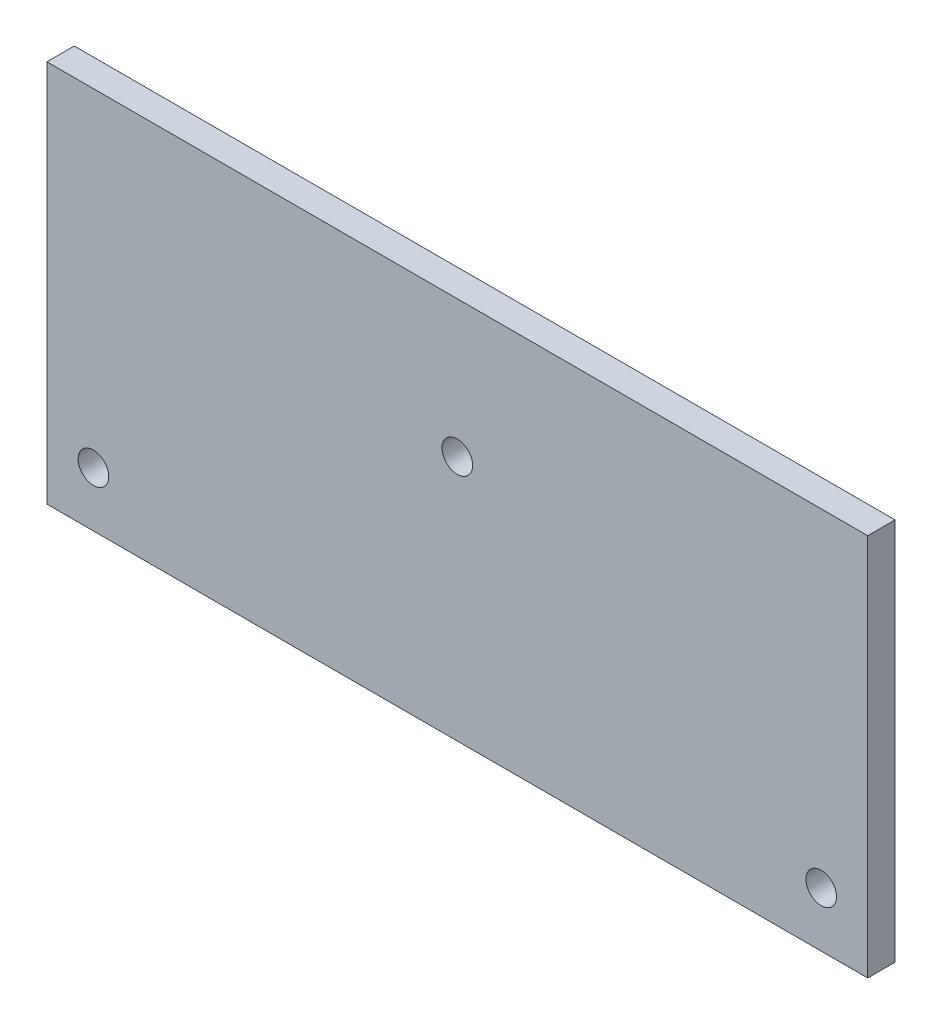
from build123d import *

# Parameters (mm, degrees)
ESQUISSE1_W        = 150
ESQUISSE1_H        = 70
ESQUISSE1_R        = 2.8
BOSS_EXTRU_1_DEPTH = 5


with BuildPart() as part:
    # Esquisse1 → Boss.-Extru.1 (new body)
    with BuildSketch(Plane.XY):
        with Locations((75, -35)):
            Rectangle(ESQUISSE1_W, ESQUISSE1_H)
        with Locations((75, -25)):
            Circle(ESQUISSE1_R, mode=Mode.SUBTRACT)
        with Locations((8.5, -60)):
            Circle(ESQUISSE1_R, mode=Mode.SUBTRACT)
        with Locations((141.5, -60)):
            Circle(ESQUISSE1_R, mode=Mode.SUBTRACT)
    extrude(amount=BOSS_EXTRU_1_DEPTH)


solid = part.part
